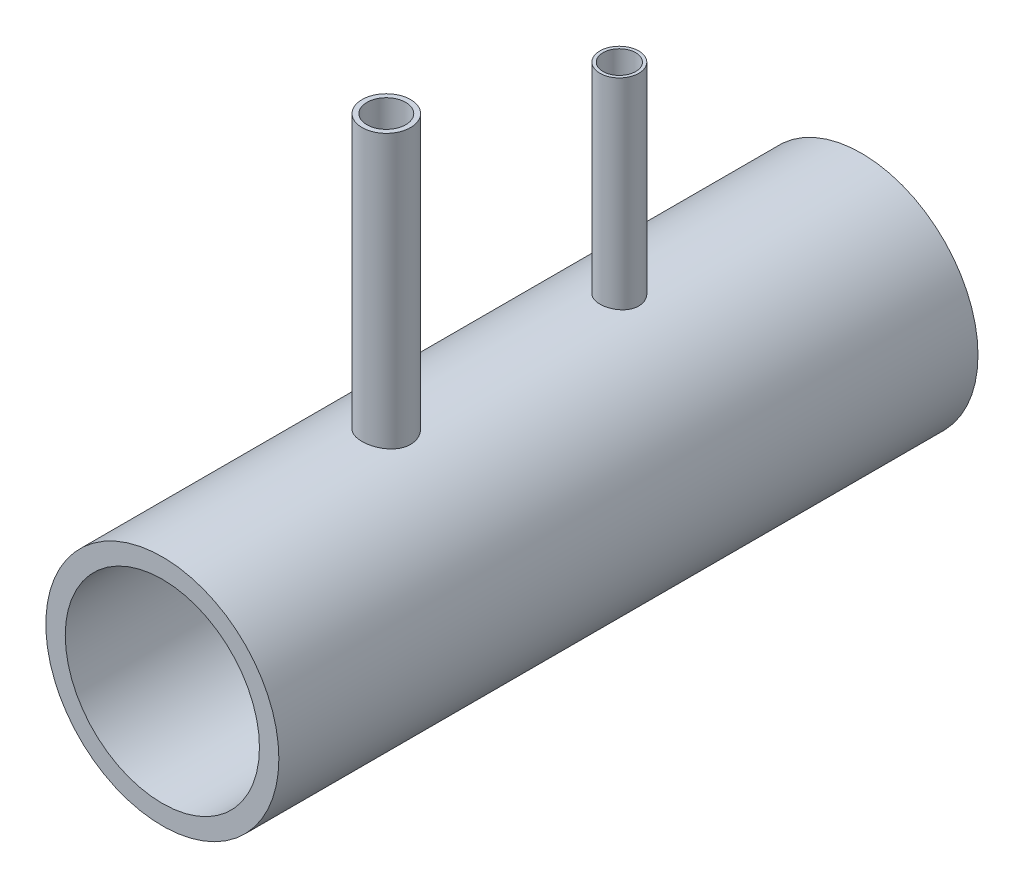
from build123d import *

# Parameters (mm, degrees)
SKETCH3_R           = 38.1
SKETCH3_R_2         = 31.75
BOSS_EXTRUDE2_DEPTH = 228.6
SKETCH5_R           = 6.35
CUT_EXTRUDE3_DEPTH  = 235.864173513
EXTRUDE_THIN1_REACH = 363.864
EXTRUDE_THIN1_START = 127
SKETCH5_3_R         = 7.9375
SKETCH5_3_R_2       = 6.35
SKETCH8_R           = 6.35
SKETCH8_R_2         = 5.35


with BuildPart() as part:
    # Sketch3 → Boss-Extrude2 (new body)
    with BuildSketch(Plane.XY):
        Circle(SKETCH3_R)
        Circle(SKETCH3_R_2, mode=Mode.SUBTRACT)
    extrude(amount=BOSS_EXTRUDE2_DEPTH)

    # Sketch5 → Cut-Extrude3 (cut, through all)
    with BuildSketch(Plane(origin=(0, 0, 0), x_dir=(1, 0, 0), z_dir=(0, 1, 0))):
        with Locations((0, -79.168272232)):
            Circle(SKETCH5_R)
        with Locations((0, -155.368272232)):
            Circle(SKETCH5_R)
    extrude(amount=CUT_EXTRUDE3_DEPTH, mode=Mode.SUBTRACT)


with BuildPart() as body_2:

    # Sketch5<3> → Extrude-Thin1 (new, up to next)
    with BuildSketch(Plane(origin=(0, 0, 0), x_dir=(1, 0, 0), z_dir=(0, 1, 0)).offset(EXTRUDE_THIN1_START), mode=Mode.PRIVATE) as extrude_thin1_sk1:
        with Locations((0, -155.368272232)):
            Circle(SKETCH5_3_R)
        with Locations((0, -155.368272232)):
            Circle(SKETCH5_3_R_2, mode=Mode.SUBTRACT)
    extrude_thin1_tool1 = extrude(extrude_thin1_sk1.sketch, amount=-EXTRUDE_THIN1_REACH, mode=Mode.PRIVATE) - part.part
    add(extrude_thin1_tool1.solids().sort_by_distance((-7.712994, 127, 155.368272))[0])


with BuildPart() as body_3:
    # Sweep-Thin1: sweep along a path in Sketch7
    with BuildLine(Plane(origin=(0, 0, 0), x_dir=(0, 0, -1), z_dir=(1, 0, 0))) as sweep_thin1_path:
        Line((-79.168272232, 103.473233019), (-79.168272232, 0))
        Line((-79.168272232, 0), (-118.741869737, 0))
    # Sketch8 → Sweep-Thin1 (sweep)
    with BuildSketch(Plane(origin=(0, 103.473233019, 79.168272232), x_dir=(1, 0, 0), z_dir=(0, 1, 0))):
        Circle(SKETCH8_R)
        Circle(SKETCH8_R_2, mode=Mode.SUBTRACT)
    sweep(path=sweep_thin1_path.line, transition=Transition.RIGHT)


solid = Compound([part.part, body_2.part, body_3.part])
